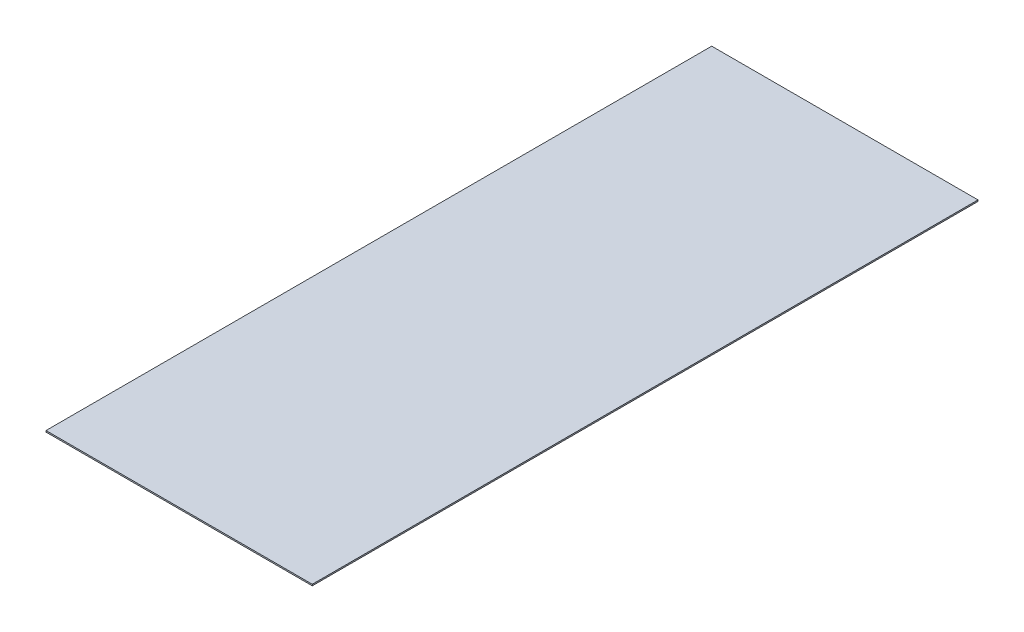
from build123d import *

# Parameters (mm, degrees)
CROQUIS1_W              = 1219.2
CROQUIS1_H              = 3048
SALIENTE_EXTRUIR1_DEPTH = 6.4


with BuildPart() as part:
    # Croquis1 → Saliente-Extruir1 (new body)
    with BuildSketch(Plane(origin=(0, 0, 0), x_dir=(1, 0, 0), z_dir=(0, 1, 0))):
        Rectangle(CROQUIS1_W, CROQUIS1_H)
    extrude(amount=SALIENTE_EXTRUIR1_DEPTH)


solid = part.part
